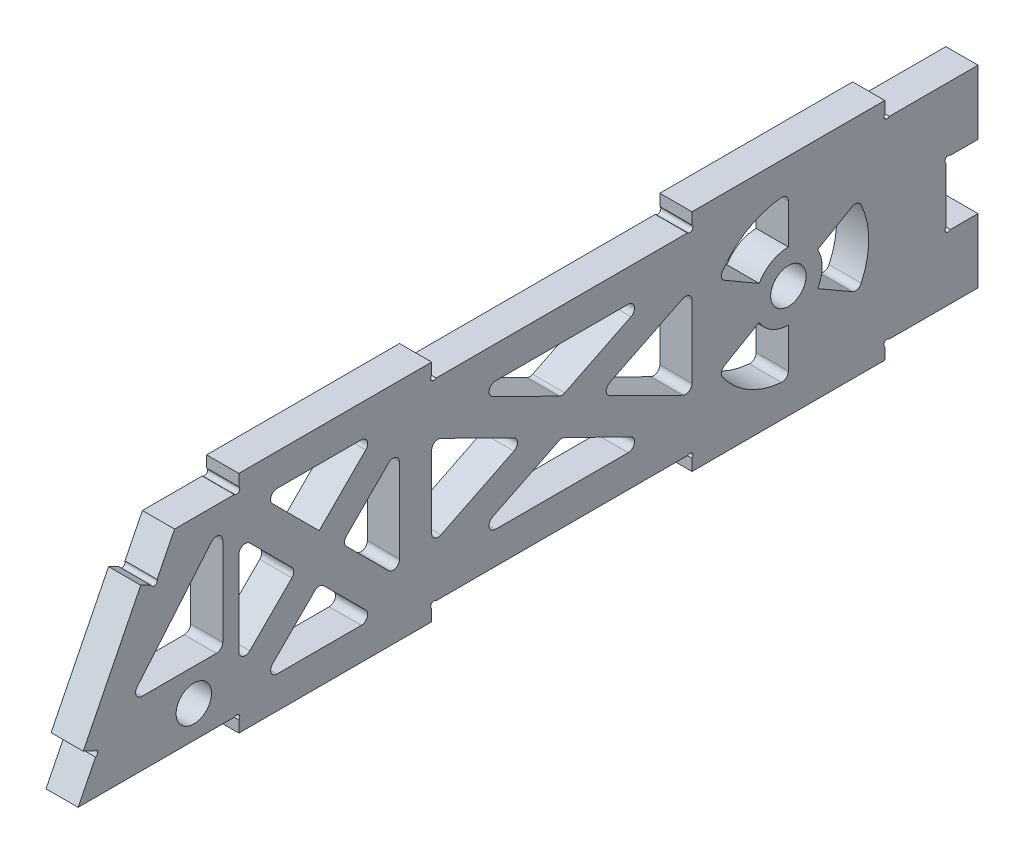
from build123d import *

# Parameters (mm, degrees)
SKETCH1_W               = 355.6
SKETCH1_H               = 76.2
BOSS_EXTRUDE1_DEPTH     = 12.7
CUT_EXTRUDE1_DEPTH      = 183.279291199
CUT_EXTRUDE1_DEPTH_BACK = 183.279291199
SKETCH3_W               = 76.2
SKETCH3_H               = 6.35
BOSS_EXTRUDE2_DEPTH     = 12.7
SKETCH4_W               = 12.7
SKETCH4_H               = 25.4
CUT_EXTRUDE2_DEPTH      = 184.711546997
SKETCH5_R               = 6.99999997
CUT_EXTRUDE3_DEPTH      = 184.711546997
CUT_EXTRUDE4_DEPTH      = 184.711546997
BOSS_EXTRUDE3_DEPTH     = 12.7
SKETCH9_R               = 1.27
CUT_EXTRUDE6_DEPTH      = 184.711546997
CUT_EXTRUDE7_DEPTH      = 184.711546997
FILLET1_R               = 2.54
FILLET2_R               = 2.54
SKETCH11_R              = 6.99999997
CUT_EXTRUDE8_DEPTH      = 184.711546997


with BuildPart() as part:
    # Sketch1 → Boss-Extrude1 (new body)
    with BuildSketch(Plane(origin=(0, 0, 0), x_dir=(0, 0, -1), z_dir=(1, 0, 0))):
        Rectangle(SKETCH1_W, SKETCH1_H)
    extrude(amount=BOSS_EXTRUDE1_DEPTH)

    # Sketch2 → Cut-Extrude1 (cut, two sides: drawn at the far end of the back side and taken through both)
    with BuildSketch(Plane(origin=(12.7, 0, 0), x_dir=(0, 0, -1), z_dir=(1, 0, 0)).offset(-CUT_EXTRUDE1_DEPTH_BACK)):
        Polygon((-507.550847217, -697.601694433), (-177.8, -38.1), (-139.7, 38.1), (190.050847217, 697.601694433), (-1128.95254165, 1357.103388866), (-1826.554236083, -38.1), align=None)
    extrude(amount=CUT_EXTRUDE1_DEPTH + CUT_EXTRUDE1_DEPTH_BACK, mode=Mode.SUBTRACT)

    # Sketch3 → Boss-Extrude2 (add)
    with BuildSketch(Plane.ZY):
        with Locations((-102.87, -41.275)):
            Rectangle(SKETCH3_W, SKETCH3_H)
        with Locations((76.2, -41.275)):
            Rectangle(SKETCH3_W, SKETCH3_H)
        with Locations((-102.87, 41.275)):
            Rectangle(SKETCH3_W, SKETCH3_H)
        with Locations((76.2, 41.275)):
            Rectangle(SKETCH3_W, SKETCH3_H)
    extrude(amount=-BOSS_EXTRUDE2_DEPTH)

    # Sketch4 → Cut-Extrude2 (cut, through all)
    with BuildSketch(Plane.ZY):
        with Locations((-171.45, 0)):
            Rectangle(SKETCH4_W, SKETCH4_H)
    extrude(amount=-CUT_EXTRUDE2_DEPTH, mode=Mode.SUBTRACT)

    # Sketch5 → Cut-Extrude3 (cut, through all)
    with BuildSketch(Plane.ZY):
        with Locations((-102.87, 0)):
            Circle(SKETCH5_R)
    extrude(amount=-CUT_EXTRUDE3_DEPTH, mode=Mode.SUBTRACT)

    # Sketch6 → Cut-Extrude4 (cut, through all)
    with BuildSketch(Plane.ZY):
        Polygon((-13.335, -7.08207294), (-50.428802297, -25.4), (23.758802297, -25.4), align=None)
        Polygon((-27.676197703, 0), (-64.77, 18.31792706), (-64.77, -18.31792706), align=None)
        Polygon((23.758802297, 25.4), (-50.428802297, 25.4), (-13.335, 7.08207294), align=None)
        Polygon((38.1, -18.31792706), (38.1, 18.31792706), (1.006197703, 0), align=None)
        Polygon((105.319743879, -31.75), (82.55, -8.980256121), (59.780256121, -31.75), align=None)
        Polygon((114.3, 22.769743879), (91.530256121, 0), (114.3, -22.769743879), align=None)
        Polygon((73.569743879, 0), (50.8, 22.769743879), (50.8, -22.769743879), align=None)
        Polygon((105.319743879, 31.75), (59.780256121, 31.75), (82.55, 8.980256121), align=None)
    extrude(amount=-CUT_EXTRUDE4_DEPTH, mode=Mode.SUBTRACT)

    # Sketch8 → Boss-Extrude3 (add)
    with BuildSketch(Plane(origin=(12.7, 0, 0), x_dir=(0, 0, -1), z_dir=(1, 0, 0))):
        Polygon((-147.390774674, 22.718450651), (-170.109225326, -22.718450651), (-175.788837989, -19.87864432), (-153.070387337, 25.558256983), align=None)
    extrude(amount=-BOSS_EXTRUDE3_DEPTH)

    # Sketch9 → Cut-Extrude6 (cut, through all)
    with BuildSketch(Plane.ZY):
        with Locations((-165.998025612, 11.801974388)):
            Circle(SKETCH9_R)
        with Locations((-165.998025612, -11.801974388)):
            Circle(SKETCH9_R)
        with Locations((-141.868025612, 38.998025612)):
            Circle(SKETCH9_R)
        with Locations((-141.868025612, -38.998025612)):
            Circle(SKETCH9_R)
        with Locations((-63.871974388, -38.998025612)):
            Circle(SKETCH9_R)
        with Locations((-63.871974388, 38.998025612)):
            Circle(SKETCH9_R)
        with Locations((37.201974388, 38.998025612)):
            Circle(SKETCH9_R)
        with Locations((37.201974388, -38.998025612)):
            Circle(SKETCH9_R)
        with Locations((115.198025612, -38.998025612)):
            Circle(SKETCH9_R)
        with Locations((115.198025612, 38.998025612)):
            Circle(SKETCH9_R)
        with Locations((147.792383937, 23.92327844)):
            Circle(SKETCH9_R)
        with Locations((171.314053114, -23.120059914)):
            Circle(SKETCH9_R)
    extrude(amount=-CUT_EXTRUDE6_DEPTH, mode=Mode.SUBTRACT)

    # Sketch10 → Cut-Extrude7 (cut, through all)
    with BuildSketch(Plane.ZY):
        with BuildLine():
            Line((-130.36630657, -15.875), (-114.431439115, -6.674999985))
            ThreePointArc((-114.431439115, -6.674999985), (-116.21999997, 0), (-114.431439115, 6.674999985))
            Line((-114.431439115, 6.674999985), (-130.36630657, 15.875))
            ThreePointArc((-130.36630657, 15.875), (-134.62, 0), (-130.36630657, -15.875))
        make_face()
        with BuildLine():
            ThreePointArc((-91.308560885, -6.674999985), (-96.195000015, -11.561439115), (-102.87, -13.34999997))
            Line((-102.87, -13.34999997), (-102.87, -31.75))
            ThreePointArc((-102.87, -31.75), (-86.995, -27.49630657), (-75.37369343, -15.875))
            Line((-75.37369343, -15.875), (-91.308560885, -6.674999985))
        make_face()
        with BuildLine():
            Line((-102.87, 31.75), (-102.87, 13.34999997))
            ThreePointArc((-102.87, 13.34999997), (-96.195000015, 11.561439115), (-91.308560885, 6.674999985))
            Line((-91.308560885, 6.674999985), (-75.37369343, 15.875))
            ThreePointArc((-75.37369343, 15.875), (-86.995, 27.49630657), (-102.87, 31.75))
        make_face()
        Polygon((158.000484171, -12.7), (120.65, 31.75), (120.65, -12.7), align=None)
    extrude(amount=-CUT_EXTRUDE7_DEPTH, mode=Mode.SUBTRACT)

    # Fillet1
    fillet1_edges = [part.edges().sort_by_distance(p)[0] for p in [
        (6.35, 15.875, -130.36630657),
        (6.35, -15.875, -130.36630657),
        (6.35, -31.75, -102.87),
        (6.35, -15.875, -75.37369343),
        (6.35, 15.875, -75.37369343),
        (6.35, 31.75, -102.87),
    ]]
    fillet(fillet1_edges, radius=FILLET1_R)

    # Fillet2
    fillet2_edges = [part.edges().sort_by_distance(p)[0] for p in [
        (6.35, -31.75, 105.319743879),
        (6.35, -31.75, 59.780256121),
        (6.35, -8.980256121, 82.55),
        (6.35, 0, 1.006197703),
        (6.35, 18.31792706, 38.1),
        (6.35, -18.31792706, 38.1),
        (6.35, 0, -27.676197703),
        (6.35, -18.31792706, -64.77),
        (6.35, 18.31792706, -64.77),
        (6.35, 25.4, -50.428802297),
        (6.35, 25.4, 23.758802297),
        (6.35, 7.08207294, -13.335),
        (6.35, 31.75, 59.780256121),
        (6.35, 31.75, 105.319743879),
        (6.35, 0, 73.569743879),
        (6.35, -22.769743879, 50.8),
        (6.35, 22.769743879, 50.8),
        (6.35, -22.769743879, 114.3),
        (6.35, 0, 91.530256121),
        (6.35, 22.769743879, 114.3),
        (6.35, -25.4, 23.758802297),
        (6.35, -25.4, -50.428802297),
        (6.35, -7.08207294, -13.335),
        (6.35, -12.7, 158.000484171),
        (6.35, -12.7, 120.65),
        (6.35, 31.75, 120.65),
    ]]
    fillet(fillet2_edges, radius=FILLET2_R)

    # Sketch11 → Cut-Extrude8 (cut, through all)
    with BuildSketch(Plane(origin=(12.7, 0, 0), x_dir=(0, 0, -1), z_dir=(1, 0, 0))):
        with Locations((-132.08, -25.4)):
            Circle(SKETCH11_R)
    extrude(amount=-CUT_EXTRUDE8_DEPTH, mode=Mode.SUBTRACT)


solid = part.part
